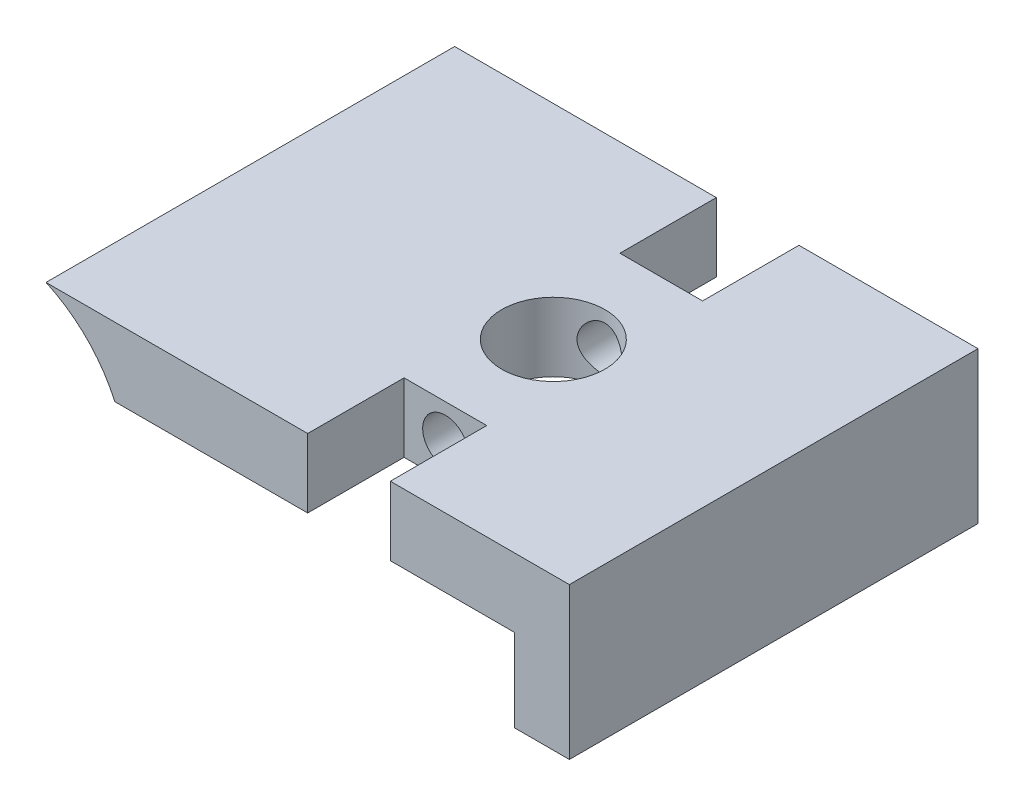
from build123d import *

# Parameters (mm, degrees)
BOSS_EXTRUDE1_DEPTH = 14.835
CUT_EXTRUDE1_REACH  = 37.321
SKETCH4_R           = 1.65
SKETCH4_3_W         = 6
SKETCH4_3_H         = 5
SKETCH4_3_R         = 1.65
CUT_EXTRUDE3_DEPTH  = 7
CUT_EXTRUDE2_REACH  = 26.619
SKETCH5_R           = 3.75
SKETCH6_W           = 4
SKETCH6_H           = 6
BOSS_EXTRUDE2_DEPTH = 29.67


with BuildPart() as part:
    # Sketch3 → Boss-Extrude1 (new, symmetric)
    with BuildSketch(Plane.XY):
        with BuildLine():
            Line((-14, -2.5), (19, -2.5))
            Line((19, -2.5), (19, 2.5))
            Line((19, 2.5), (-19, 2.5))
            ThreePointArc((-19, 2.5), (-16.043310466, 0.456689534), (-14, -2.5))
        make_face()
    extrude(amount=BOSS_EXTRUDE1_DEPTH, both=True)

    # Sketch4 → Cut-Extrude1 (cut, up to next)
    with BuildSketch(Plane.XY.offset(14.835), mode=Mode.PRIVATE) as cut_extrude1_sk1:
        with Locations((3, 0)):
            Circle(SKETCH4_R)
    cut_extrude1_tool1 = extrude(cut_extrude1_sk1.sketch, amount=-CUT_EXTRUDE1_REACH, mode=Mode.PRIVATE) & part.part
    add(cut_extrude1_tool1.solids().sort_by_distance((3, 0, 14.835))[0], mode=Mode.SUBTRACT)

    # Sketch4<3> → Cut-Extrude3 (cut)
    with BuildSketch(Plane.XY.offset(14.835)):
        with Locations((3, 0)):
            Rectangle(SKETCH4_3_W, SKETCH4_3_H)
        with Locations((3, 0)):
            Circle(SKETCH4_3_R, mode=Mode.SUBTRACT)
    cut_extrude3 = extrude(amount=-CUT_EXTRUDE3_DEPTH, mode=Mode.SUBTRACT)

    # Mirror1: Cut-Extrude3 across plane
    add(cut_extrude3.mirror(Plane.XY), mode=Mode.SUBTRACT)

    # Sketch5 → Cut-Extrude2 (cut, up to next)
    with BuildSketch(Plane(origin=(0, 2.5, 0), x_dir=(1, 0, 0), z_dir=(0, 1, 0)), mode=Mode.PRIVATE) as cut_extrude2_sk1:
        with Locations(Location((3, 0, 0), (0, 0, 270))):
            Circle(SKETCH5_R)
    cut_extrude2_tool1 = extrude(cut_extrude2_sk1.sketch, amount=-CUT_EXTRUDE2_REACH, mode=Mode.PRIVATE) & part.part
    add(cut_extrude2_tool1.solids().sort_by_distance((3, 2.5, 0))[0], mode=Mode.SUBTRACT)

    # Sketch6 → Boss-Extrude2 (add)
    with BuildSketch(Plane.XY.offset(14.835)):
        with Locations((17, -5.5)):
            Rectangle(SKETCH6_W, SKETCH6_H)
    extrude(amount=-BOSS_EXTRUDE2_DEPTH)


solid = part.part
